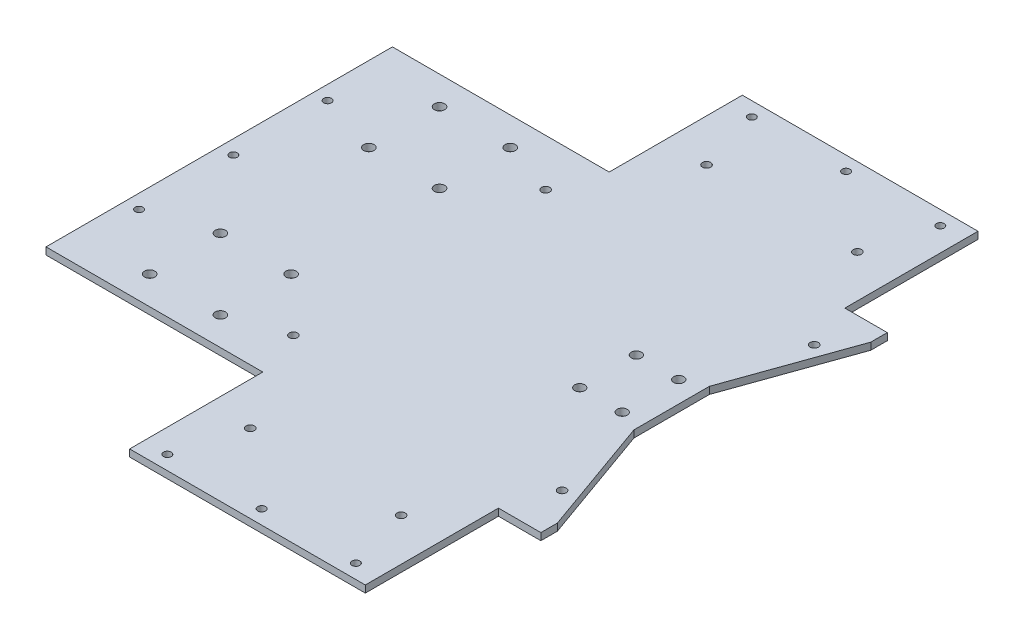
from build123d import *

# Parameters (mm, degrees)
EXTRUDE_1_DEPTH     = 3
SKETCH_2_R          = 2.15
SKETCH_2_R_2        = 1.65
SKETCH_2_R_3        = 2.2
CUT_EXTRUDE_1_DEPTH = 10
SKETCH_3_R          = 1.75
CUT_EXTRUDE_2_DEPTH = 4.5


with BuildPart() as part:
    # 草图1 → 凸台-拉伸1 (new body)
    with BuildSketch(Plane(origin=(0, 0, 0), x_dir=(1, 0, 0), z_dir=(0, 1, 0))):
        Polygon((-105, -73.5), (-13, -73.5), (-13, -130), (87, -130), (87, -73.5), (105, -73.5), (105, -66.5), (87, -16), (87, 16), (105, 66.5), (105, 73.5), (87, 73.5), (87, 130), (-13, 130), (-13, 73.5), (-105, 73.5), align=None)
    extrude(amount=EXTRUDE_1_DEPTH)

    # 草图2 → 切除-拉伸1 (cut)
    with BuildSketch(Plane.XZ):
        with Locations(Location((78, -12, 0), (0, 0, 270))):
            Circle(SKETCH_2_R)
        with Locations(Location((60, -12, 0), (0, 0, 270))):
            Circle(SKETCH_2_R)
        with Locations(Location((60, 12, 0), (0, 0, 90))):
            Circle(SKETCH_2_R)
        with Locations(Location((78, 12, 0), (0, 0, 90))):
            Circle(SKETCH_2_R)
        with Locations(Location((-3, -124, 0), (0, 0, 270))):
            Circle(SKETCH_2_R_2)
        with Locations(Location((37, -124, 0), (0, 0, 270))):
            Circle(SKETCH_2_R_2)
        with Locations(Location((77, -124, 0), (0, 0, 270))):
            Circle(SKETCH_2_R_2)
        with Locations(Location((77, 124, 0), (0, 0, 90))):
            Circle(SKETCH_2_R_2)
        with Locations(Location((37, 124, 0), (0, 0, 90))):
            Circle(SKETCH_2_R_2)
        with Locations(Location((-3, 124, 0), (0, 0, 90))):
            Circle(SKETCH_2_R_2)
        with Locations(Location((-99, -40, 0), (0, 0, 270))):
            Circle(SKETCH_2_R_2)
        with Locations(Location((-99, 40, 0), (0, 0, 90))):
            Circle(SKETCH_2_R_2)
        with Locations(Location((-73, 61.5, 0), (0, 0, 270))):
            Circle(SKETCH_2_R_3)
        with Locations(Location((-73, 31.5, 0), (0, 0, 270))):
            Circle(SKETCH_2_R_3)
        with Locations(Location((-43, 61.5, 0), (0, 0, 90))):
            Circle(SKETCH_2_R_3)
        with Locations(Location((-43, 31.5, 0), (0, 0, 90))):
            Circle(SKETCH_2_R_3)
        with Locations(Location((-43, -31.5, 0), (0, 0, 270))):
            Circle(SKETCH_2_R_3)
        with Locations(Location((-43, -61.5, 0), (0, 0, 270))):
            Circle(SKETCH_2_R_3)
        with Locations(Location((-73, -31.5, 0), (0, 0, 90))):
            Circle(SKETCH_2_R_3)
        with Locations(Location((-73, -61.5, 0), (0, 0, 90))):
            Circle(SKETCH_2_R_3)
        with Locations(Location((-99, 0, 0), (0, 0, 270))):
            Circle(SKETCH_2_R_2)
    extrude(amount=-CUT_EXTRUDE_1_DEPTH, mode=Mode.SUBTRACT)

    # 草图3 → 切除-拉伸2 (cut)
    with BuildSketch(Plane(origin=(0, 3, 0), x_dir=(1, 0, 0), z_dir=(0, 1, 0))):
        with Locations(Location((-20.002701991, 53.5, 0), (0, 0, 270))):
            Circle(SKETCH_3_R)
        with Locations(Location((4.997298009, 96.801270189, 0), (0, 0, 270))):
            Circle(SKETCH_3_R)
        with Locations(Location((69.002701991, 96.801270189, 0), (0, 0, 270))):
            Circle(SKETCH_3_R)
        with Locations(Location((94.002701991, 53.5, 0), (0, 0, 270))):
            Circle(SKETCH_3_R)
        with Locations(Location((94.002701991, -53.5, 0), (0, 0, 270))):
            Circle(SKETCH_3_R)
        with Locations(Location((69.002701991, -96.801270189, 0), (0, 0, 270))):
            Circle(SKETCH_3_R)
        with Locations(Location((4.997298009, -96.801270189, 0), (0, 0, 270))):
            Circle(SKETCH_3_R)
        with Locations(Location((-20.002701991, -53.5, 0), (0, 0, 270))):
            Circle(SKETCH_3_R)
    extrude(amount=-CUT_EXTRUDE_2_DEPTH, mode=Mode.SUBTRACT)


solid = part.part
